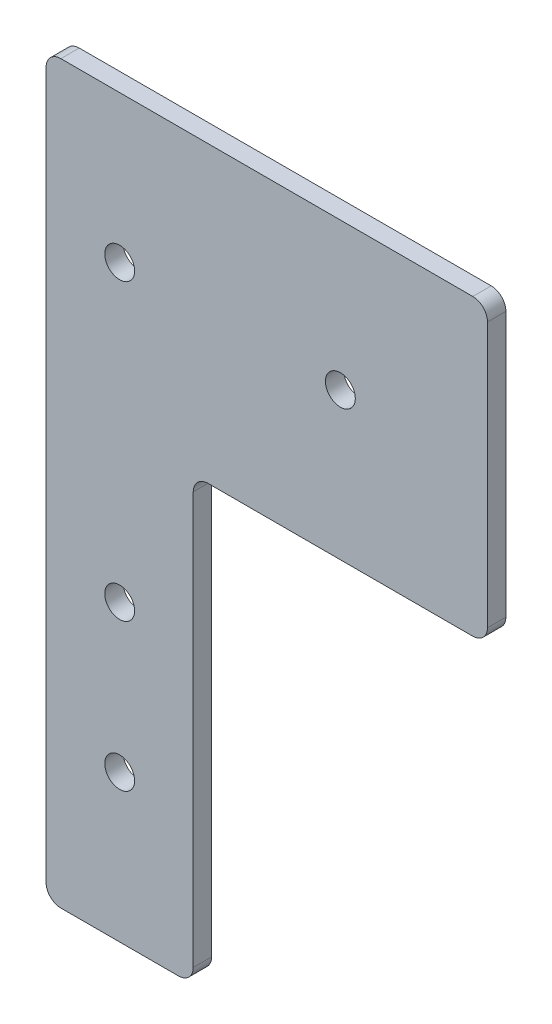
from build123d import *

# Parameters (mm, degrees)
BOSS_EXTRUDE1_DEPTH = 3.175
SKETCH2_R           = 2.5796875
CUT_EXTRUDE1_DEPTH  = 3.175
FILLET1_R           = 2.54


with BuildPart() as part:
    # Sketch1 → Boss-Extrude1 (new body)
    with BuildSketch(Plane.XY):
        Polygon((-12.7, -63.5), (12.7, -63.5), (12.7, 12.7), (63.5, 12.7), (63.5, 63.5), (12.7, 63.5), (-12.7, 63.5), align=None)
    extrude(amount=BOSS_EXTRUDE1_DEPTH)

    # Sketch2 → Cut-Extrude1 (cut)
    with BuildSketch(Plane.XY.offset(3.175)):
        with Locations((0, 38.1)):
            Circle(SKETCH2_R)
        with Locations((38.1, 38.1)):
            Circle(SKETCH2_R)
        with Locations((0, -38.1)):
            Circle(SKETCH2_R)
        with Locations((0, -12.7)):
            Circle(SKETCH2_R)
    extrude(amount=-CUT_EXTRUDE1_DEPTH, mode=Mode.SUBTRACT)

    # Fillet1
    fillet1_edges = [part.edges().sort_by_distance(p)[0] for p in [
        (63.5, 63.5, 1.5875),
        (63.5, 12.7, 1.5875),
        (12.7, 12.7, 1.5875),
        (12.7, -63.5, 1.5875),
        (-12.7, -63.5, 1.5875),
        (-12.7, 63.5, 1.5875),
    ]]
    fillet(fillet1_edges, radius=FILLET1_R)


solid = part.part
